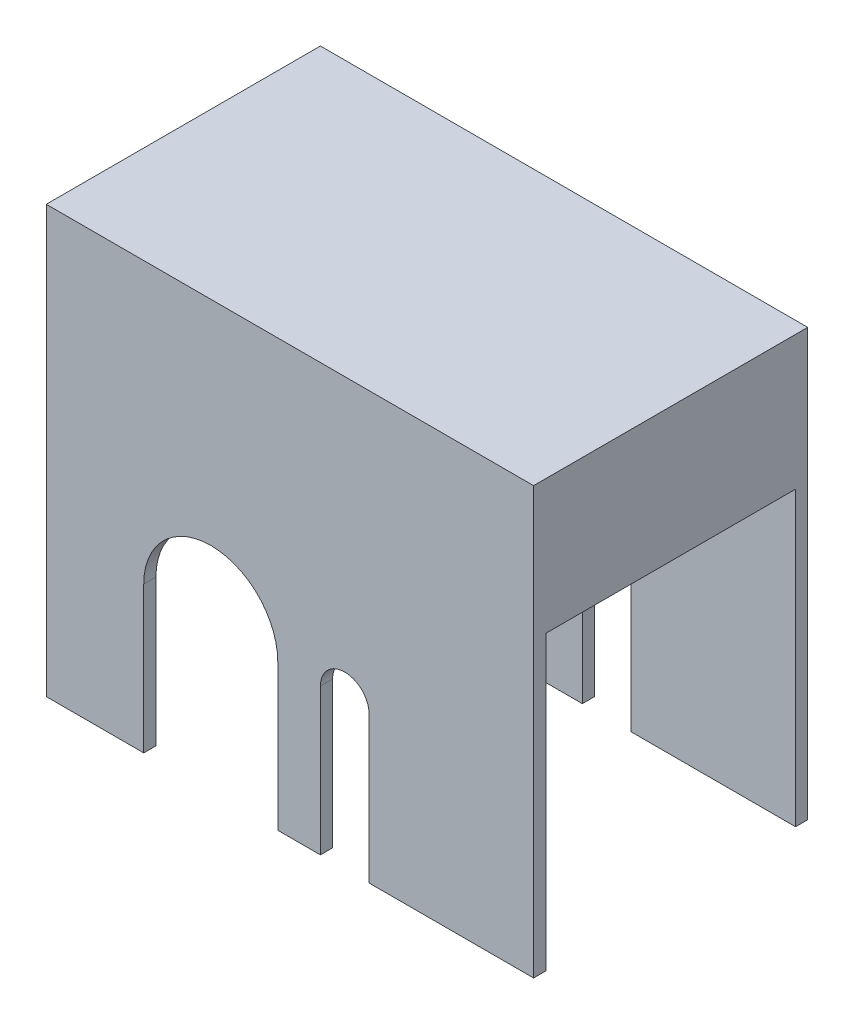
from build123d import *

# Parameters (mm, degrees)
SKETCH_2_W                = 40
SKETCH_2_H                = 22.5
EXTRUDE_2_DEPTH           = 25
SHELL_3_T                 = -1
CUT_EXTRUDE_2_DEPTH       = 56.37502058
CUT_EXTRUDE_2_DEPTH_BACK  = 1
CUT_EXTRUDE_10_DEPTH      = 56.37502058
CUT_EXTRUDE_10_DEPTH_BACK = 1
SKETCH_6_W                = 40
SKETCH_6_H                = 22.5
EXTRUDE_3_DEPTH           = 10


with BuildPart() as part:
    # 草图2 → 凸台-拉伸2 (new body)
    with BuildSketch(Plane(origin=(0, 0, 0), x_dir=(1, 0, 0), z_dir=(0, 1, 0))):
        with Locations((-23.990259198, 8.7812953)):
            Rectangle(SKETCH_2_W, SKETCH_2_H)
    extrude(amount=EXTRUDE_2_DEPTH)

    # 抽壳3
    shell_3_openings = [part.faces().sort_by_distance(p)[0] for p in [
        (-23.990259198, 0, -8.7812953),
        (-3.990259198, 12.5, -8.7812953),
        (-43.990259198, 12.5, -8.7812953),
    ]]
    offset(amount=SHELL_3_T, openings=shell_3_openings, kind=Kind.INTERSECTION)

    # 草图4 → 切除-拉伸2 (cut, two sides: drawn at the far end of the back side and taken through both)
    with BuildSketch(Plane.XY.offset(2.4687047).offset(-CUT_EXTRUDE_2_DEPTH_BACK)):
        with BuildLine():
            Line((-24.990259198, 12), (-24.990259198, 0))
            Line((-24.990259198, 0), (-35.990259198, 0))
            Line((-35.990259198, 0), (-35.990259198, 12))
            ThreePointArc((-35.990259198, 12), (-30.490259198, 17.5), (-24.990259198, 12))
        make_face()
        with BuildLine():
            Line((-21.490259198, 12), (-21.490259198, 0))
            Line((-21.490259198, 0), (-17.490259198, 0))
            Line((-17.490259198, 0), (-17.490259198, 12))
            ThreePointArc((-17.490259198, 12), (-19.490259198, 14), (-21.490259198, 12))
        make_face()
    extrude(amount=CUT_EXTRUDE_2_DEPTH + CUT_EXTRUDE_2_DEPTH_BACK, mode=Mode.SUBTRACT)

    # 草图5 → 切除-拉伸10 (cut, two sides: drawn at the far end of the back side and taken through both)
    with BuildSketch(Plane(origin=(0, 0, -20.0312953), x_dir=(-1, 0, 0), z_dir=(0, 0, -1)).offset(-CUT_EXTRUDE_10_DEPTH_BACK)):
        with BuildLine():
            Line((35.990259198, 12), (35.990259198, 0))
            Line((35.990259198, 0), (24.990259198, 0))
            Line((24.990259198, 0), (24.990259198, 12))
            ThreePointArc((24.990259198, 12), (30.490259198, 17.5), (35.990259198, 12))
        make_face()
        with BuildLine():
            Line((17.490259198, 12), (17.490259198, 0))
            Line((17.490259198, 0), (21.490259198, 0))
            Line((21.490259198, 0), (21.490259198, 12))
            ThreePointArc((21.490259198, 12), (19.490259198, 14), (17.490259198, 12))
        make_face()
    extrude(amount=CUT_EXTRUDE_10_DEPTH + CUT_EXTRUDE_10_DEPTH_BACK, mode=Mode.SUBTRACT)

    # 草图6 → 凸台-拉伸3 (add)
    with BuildSketch(Plane(origin=(0, 25, 0), x_dir=(1, 0, 0), z_dir=(0, 1, 0))):
        with Locations((-23.990259198, 8.7812953)):
            Rectangle(SKETCH_6_W, SKETCH_6_H)
    extrude(amount=EXTRUDE_3_DEPTH)


solid = part.part
